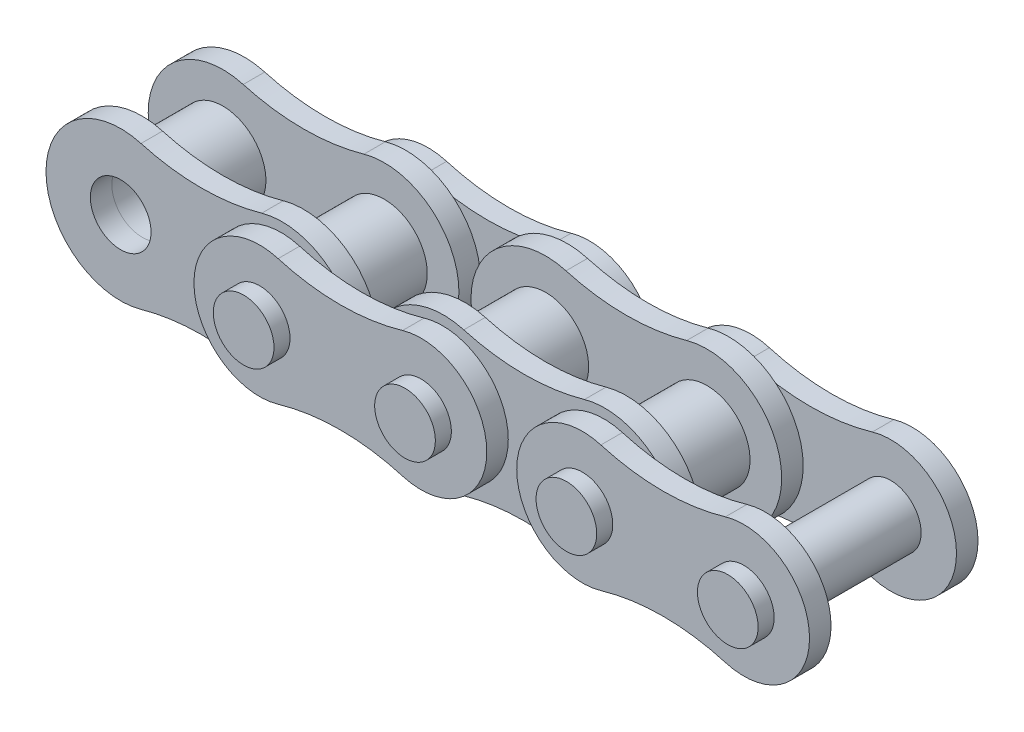
from build123d import *

# Parameters (mm, degrees)
SKETCH4_R                  = 2.54
SKETCH4_R_2                = 1.8161
BOSS_EXTRUDE1_DEPTH        = 2.38125
BOSS_EXTRUDE1_2_DEPTH      = 2.38125
SKETCH5_R                  = 1.7907
BOSS_EXTRUDE2_DEPTH        = 1.27
LPATTERN1_COUNT            = 2
LPATTERN1_PITCH            = 9.525
SKETCH7_R                  = 1.7907
BOSS_EXTRUDE3_DEPTH        = 1.27
BOSS_EXTRUDE4_DEPTH        = 5.9182
BOSS_EXTRUDE4_DEPTH_BACK   = 5.9182
SKETCH8_R                  = 1.7907
BOSS_EXTRUDE4_2_DEPTH      = 5.9182
BOSS_EXTRUDE4_2_DEPTH_BACK = 5.9182
LPATTERN2_COUNT            = 2
LPATTERN2_PITCH            = 19.05


with BuildPart() as part:
    # Sketch4 → Boss-Extrude1 (new, symmetric)
    with BuildSketch(Plane.XY):
        with Locations(Location((-4.7625, 0, 0), (0, 0, 180))):
            Circle(SKETCH4_R)
        with Locations(Location((-4.7625, 0, 0), (0, 0, 180))):
            Circle(SKETCH4_R_2, mode=Mode.SUBTRACT)
    extrude(amount=BOSS_EXTRUDE1_DEPTH, both=True)


with BuildPart() as body_2:
    # Sketch4 → Boss-Extrude1 2 (new, symmetric)
    with BuildSketch(Plane.XY):
        with Locations(Location((4.7625, 0, 0), (0, 0, 180))):
            Circle(SKETCH4_R)
        with Locations(Location((4.7625, 0, 0), (0, 0, 180))):
            Circle(SKETCH4_R_2, mode=Mode.SUBTRACT)
    extrude(amount=BOSS_EXTRUDE1_2_DEPTH, both=True)


with BuildPart() as body_3:
    # Sketch5 → Boss-Extrude2 (new body)
    with BuildSketch(Plane.XY.offset(2.38125)):
        with BuildLine():
            ThreePointArc((-3.562267566, 4.240307738), (-9.1694, 0), (-3.562267566, -4.240307738))
            ThreePointArc((-3.562267566, -4.240307738), (0, -3.745865), (3.562267566, -4.240307738))
            ThreePointArc((3.562267566, -4.240307738), (9.1694, 0), (3.562267566, 4.240307738))
            ThreePointArc((3.562267566, 4.240307738), (0, 3.745865), (-3.562267566, 4.240307738))
        make_face()
        with Locations((-4.7625, 0)):
            Circle(SKETCH5_R, mode=Mode.SUBTRACT)
        with Locations((4.7625, 0)):
            Circle(SKETCH5_R, mode=Mode.SUBTRACT)
    extrude(amount=BOSS_EXTRUDE2_DEPTH)


with BuildPart() as lpattern1_1:
    # LPattern1: pattern copy
    add(body_2.part.moved(Location(Vector(1, 0, 0) * (1 * LPATTERN1_PITCH))))


with BuildPart() as body_5:
    # Sketch7 → Boss-Extrude3 (new body)
    with BuildSketch(Plane.XY.offset(-3.70205)):
        with BuildLine():
            ThreePointArc((5.851642473, 3.721990208), (0.884428, 0), (5.851642473, -3.721990208))
            ThreePointArc((5.851642473, -3.721990208), (9.525, -3.195572188), (13.198357527, -3.721990208))
            ThreePointArc((13.198357527, -3.721990208), (18.165572, 0), (13.198357527, 3.721990208))
            ThreePointArc((13.198357527, 3.721990208), (9.525, 3.195572188), (5.851642473, 3.721990208))
        make_face()
        with Locations((4.7625, 0)):
            Circle(SKETCH7_R, mode=Mode.SUBTRACT)
        with Locations((14.2875, 0)):
            Circle(SKETCH7_R, mode=Mode.SUBTRACT)
    extrude(amount=-BOSS_EXTRUDE3_DEPTH)


with BuildPart() as body_6:
    # Mirror1: mirrored copy
    add(body_3.part.mirror(Plane.XY))


with BuildPart() as body_7:
    # Mirror1 2: mirrored copy
    add(body_5.part.mirror(Plane.XY))


with BuildPart() as body_8:
    # Sketch8 → Boss-Extrude4 (new, two sides: drawn at the far end of the back side and taken through both)
    with BuildSketch(Plane.XY.offset(-BOSS_EXTRUDE4_DEPTH_BACK)):
        with Locations((4.7625, 0)):
            Circle(SKETCH8_R)
    extrude(amount=BOSS_EXTRUDE4_DEPTH + BOSS_EXTRUDE4_DEPTH_BACK)


with BuildPart() as body_9:
    # Sketch8 → Boss-Extrude4 2 (new, two sides: drawn at the far end of the back side and taken through both)
    with BuildSketch(Plane.XY.offset(-BOSS_EXTRUDE4_2_DEPTH_BACK)):
        with Locations((14.2875, 0)):
            Circle(SKETCH8_R)
    extrude(amount=BOSS_EXTRUDE4_2_DEPTH + BOSS_EXTRUDE4_2_DEPTH_BACK)


with BuildPart() as lpattern2_1:
    # LPattern2: pattern copy
    add(body_9.part.moved(Location(Vector(1, 0, 0) * (1 * LPATTERN2_PITCH))))


with BuildPart() as lpattern2_2:
    # LPattern2: pattern copy
    add(body_8.part.moved(Location(Vector(1, 0, 0) * (1 * LPATTERN2_PITCH))))


with BuildPart() as lpattern2_3:
    # LPattern2: pattern copy
    add(body_7.part.moved(Location(Vector(1, 0, 0) * (1 * LPATTERN2_PITCH))))


with BuildPart() as lpattern2_4:
    # LPattern2: pattern copy
    add(body_6.part.moved(Location(Vector(1, 0, 0) * (1 * LPATTERN2_PITCH))))


with BuildPart() as lpattern2_5:
    # LPattern2: pattern copy
    add(body_5.part.moved(Location(Vector(1, 0, 0) * (1 * LPATTERN2_PITCH))))


with BuildPart() as lpattern2_6:
    # LPattern2: pattern copy
    add(lpattern1_1.part.moved(Location(Vector(1, 0, 0) * (1 * LPATTERN2_PITCH))))


with BuildPart() as lpattern2_7:
    # LPattern2: pattern copy
    add(body_3.part.moved(Location(Vector(1, 0, 0) * (1 * LPATTERN2_PITCH))))


with BuildPart() as lpattern2_8:
    # LPattern2: pattern copy
    add(body_2.part.moved(Location(Vector(1, 0, 0) * (1 * LPATTERN2_PITCH))))


with BuildPart() as lpattern2_9:
    # LPattern2: pattern copy
    add(part.part.moved(Location(Vector(1, 0, 0) * (1 * LPATTERN2_PITCH))))


with BuildPart() as body_2_1:
    add(body_2.part)

    # Combine1: union body 3, LPattern1_1, body 5, body 6, body 7, body 8, body 9, LPattern2_1, LPattern2_2, LPattern2_3, LPattern2_4, LPattern2_5, LPattern2_7, LPattern2_8, LPattern2_9, part
    add(body_3.part)
    add(lpattern1_1.part)
    add(body_5.part)
    add(body_6.part)
    add(body_7.part)
    add(body_8.part)
    add(body_9.part)
    add(lpattern2_1.part)
    add(lpattern2_2.part)
    add(lpattern2_3.part)
    add(lpattern2_4.part)
    add(lpattern2_5.part)
    add(lpattern2_7.part)
    add(lpattern2_8.part)
    add(lpattern2_9.part)
    add(part.part)


solid = body_2_1.part
